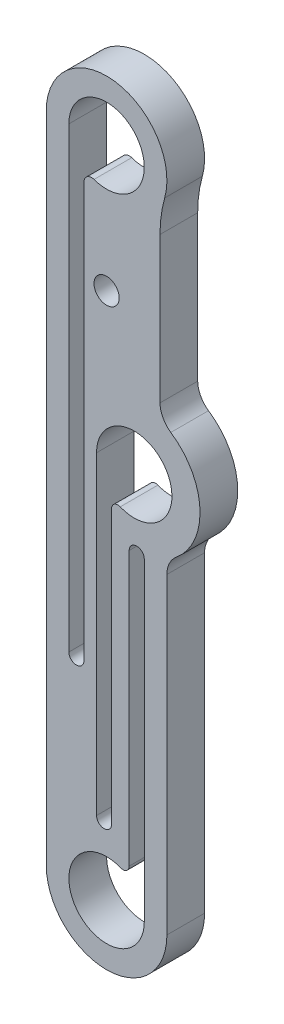
from build123d import *

# Parameters (mm, degrees)
SKETCH_1_R      = 1
EXTRUDE_1_DEPTH = 3


with BuildPart() as part:
    # 草图1 → 凸台-拉伸1 (new body)
    with BuildSketch(Plane.XY):
        with BuildLine():
            Line((-374.926675411, 73.771047931), (-374.926675411, 85.377996683))
            ThreePointArc((-374.926675411, 85.377996683), (-374.833212563, 86.742006081), (-374.554571083, 88.080518639))
            ThreePointArc((-374.554571083, 88.080518639), (-378.521236494, 94.132867012), (-383.975961006, 89.377729178))
            Line((-383.975961006, 89.377729178), (-383.975961006, 52.22545565))
            Line((-383.975961006, 52.22545565), (-383.975961006, 37.377729178))
            ThreePointArc((-383.975961006, 37.377729178), (-379.175961006, 32.577729178), (-374.375961006, 37.377729178))
            Line((-374.375961006, 37.377729178), (-374.375961006, 62.224119392))
            ThreePointArc((-374.375961006, 62.224119392), (-374.18461917, 63.077791251), (-373.647205362, 63.76811997))
            ThreePointArc((-373.647205362, 63.76811997), (-371.745473945, 68.072262412), (-374.066514555, 72.165548992))
            ThreePointArc((-374.066514555, 72.165548992), (-374.68996635, 72.864697969), (-374.926675411, 73.771047931))
        make_face()
        with Locations((-379.175961006, 79.377729178)):
            Circle(SKETCH_1_R, mode=Mode.SUBTRACT)
        with BuildLine():
            Line((-382.175961006, 89.377729178), (-382.175961006, 52.97993897))
            ThreePointArc((-382.175961006, 52.97993897), (-381.575961006, 52.37993897), (-380.975961006, 52.97993897))
            Line((-380.975961006, 52.97993897), (-380.975961006, 85.964352253))
            ThreePointArc((-380.975961006, 85.964352253), (-380.724426098, 86.459873764), (-380.175961006, 86.549302053))
            ThreePointArc((-380.175961006, 86.549302053), (-376.726471263, 91.109779986), (-382.175961006, 89.377729178))
        make_face(mode=Mode.SUBTRACT)
        with BuildLine():
            Line((-378.775961006, 42.811088271), (-378.775961006, 64.56147291))
            ThreePointArc((-378.775961006, 64.56147291), (-378.556266961, 64.975512245), (-378.09024672, 65.025703676))
            ThreePointArc((-378.09024672, 65.025703676), (-374.491724992, 69.492924003), (-379.975961006, 67.811088271))
            Line((-379.975961006, 67.811088271), (-379.975961006, 42.811088271))
            ThreePointArc((-379.975961006, 42.811088271), (-379.375961006, 42.211088271), (-378.775961006, 42.811088271))
        make_face(mode=Mode.SUBTRACT)
        with BuildLine():
            Line((-376.175961006, 37.377729178), (-376.175961006, 62.377729178))
            ThreePointArc((-376.175961006, 62.377729178), (-376.775961006, 62.977729178), (-377.375961006, 62.377729178))
            Line((-377.375961006, 62.377729178), (-377.375961006, 40.62734454))
            ThreePointArc((-377.375961006, 40.62734454), (-377.59565505, 40.213305204), (-378.061675291, 40.163113774))
            ThreePointArc((-378.061675291, 40.163113774), (-381.660197019, 35.695893446), (-376.175961006, 37.377729178))
        make_face(mode=Mode.SUBTRACT)
    extrude(amount=EXTRUDE_1_DEPTH)


solid = part.part
